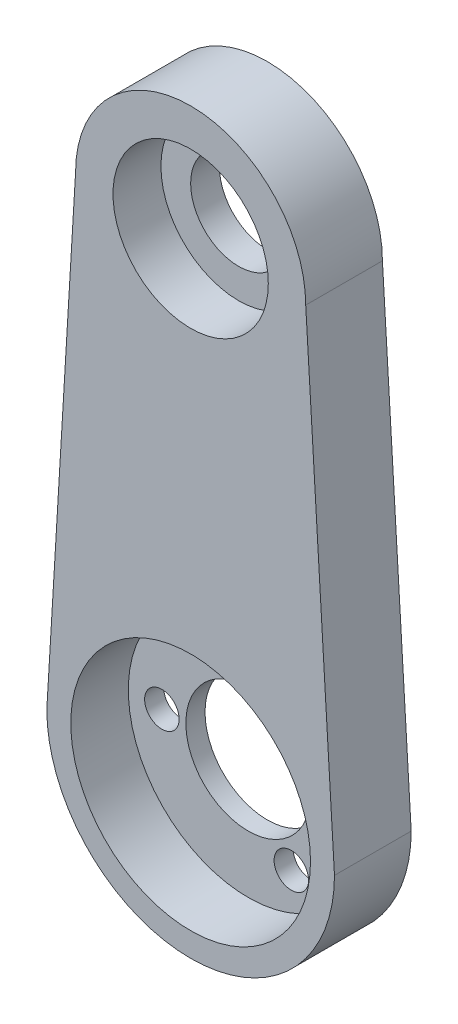
from build123d import *

# Parameters (mm, degrees)
BOSS_EXTRU_1_DEPTH      = 8
ESQUISSE2_R             = 6.5
ENL_V_MAT_EXTRU_1_DEPTH = 10
ESQUISSE3_R             = 1.8
ENL_V_MAT_EXTRU_2_DEPTH = 10
ESQUISSE5_R             = 12.5
ENL_V_MAT_EXTRU_5_DEPTH = 6
ESQUISSE19_R            = 8.1
ENL_V_MAT_EXTRU_6_DEPTH = 10
BOSS_EXTRU_2_START      = -3
ESQUISSE22_R            = 8.1
ESQUISSE22_R_2          = 5
BOSS_EXTRU_2_DEPTH      = 3


with BuildPart() as part:
    # Esquisse1 → Boss.-Extru.1 (new body)
    with BuildSketch(Plane.XY):
        with BuildLine():
            Line((12, 0), (15, -50))
            ThreePointArc((15, -50), (0, -65), (-15, -50))
            Line((-15, -50), (-12, 0))
            ThreePointArc((-12, 0), (0, 12), (12, 0))
        make_face()
    extrude(amount=BOSS_EXTRU_1_DEPTH)

    # Esquisse2 → Enlèv. mat.-Extru.1 (cut)
    with BuildSketch(Plane.XY.offset(8)):
        with Locations((0, -50)):
            Circle(ESQUISSE2_R)
    extrude(amount=-ENL_V_MAT_EXTRU_1_DEPTH, mode=Mode.SUBTRACT)

    # Esquisse3 → Enlèv. mat.-Extru.2 (cut)
    with BuildSketch(Plane.XY.offset(8)):
        with Locations((4.5, -57.794228634)):
            Circle(ESQUISSE3_R)
        with Locations((-9, -50)):
            Circle(ESQUISSE3_R)
        with Locations((4.5, -42.205771366)):
            Circle(ESQUISSE3_R)
    extrude(amount=-ENL_V_MAT_EXTRU_2_DEPTH, mode=Mode.SUBTRACT)

    # Esquisse5 → Enlèv. mat.-Extru.5 (cut)
    with BuildSketch(Plane.XY.offset(8)):
        with Locations((0, -50)):
            Circle(ESQUISSE5_R)
    extrude(amount=-ENL_V_MAT_EXTRU_5_DEPTH, mode=Mode.SUBTRACT)

    # Esquisse19 → Enlèv. mat.-Extru.6 (cut)
    with BuildSketch(Plane.XY.offset(8)):
        Circle(ESQUISSE19_R)
    extrude(amount=-ENL_V_MAT_EXTRU_6_DEPTH, mode=Mode.SUBTRACT)

    # Esquisse22 → Boss.-Extru.2 (add)
    with BuildSketch(Plane(origin=(0, 0, 0), x_dir=(-1, 0, 0), z_dir=(0, 0, -1)).offset(BOSS_EXTRU_2_START)):
        with Locations(Location((0, 0, 0), (0, 0, 180))):
            Circle(ESQUISSE22_R)
        Circle(ESQUISSE22_R_2, mode=Mode.SUBTRACT)
    extrude(amount=BOSS_EXTRU_2_DEPTH)


solid = part.part
